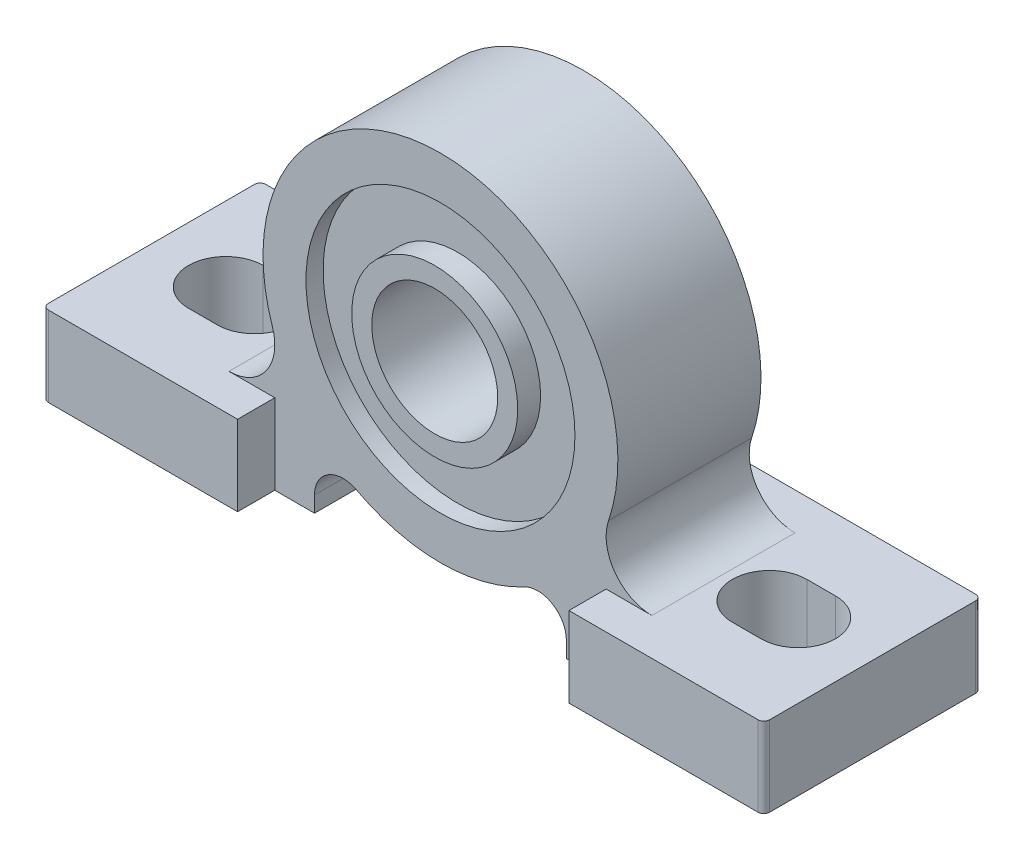
from build123d import *

# Parameters (mm, degrees)
SKETCH_8_R          = 14.5
SKETCH_8_R_2        = 11
EXTRUDE_1_DEPTH     = 31
SKETCH_10_R         = 23.5
SKETCH_10_R_2       = 14.5
EXTRUDE_2_DEPTH     = 17
EXTRUDE_START       = -5
SKETCH_11_R         = 31
SKETCH_11_R_2       = 23.5
EXTRUDE_3_DEPTH     = 25
SKETCH_13_W         = 41
SKETCH_13_H         = 38
EXTRUDE_4_DEPTH     = 14
FILLET_1_R          = 8
FILLET_2_R          = 5
FILLET_3_R          = 5
FILLET_4_R          = 8
FILLET_5_R          = 1
FILLET_6_R          = 1
SKETCH_14_W         = 12.689774382
SKETCH_14_H         = 9.496761799
CUT_EXTRUDE_5_DEPTH = 130.435312029


with BuildPart() as part:
    # Эскиз8 → Вытянуть1 (new body)
    with BuildSketch(Plane.XY):
        with Locations((50, -1.5)):
            Circle(SKETCH_8_R)
        with Locations((50, -1.5)):
            Circle(SKETCH_8_R_2, mode=Mode.SUBTRACT)
    extrude(amount=EXTRUDE_1_DEPTH)

    # Эскиз10 → Вытянуть2 (add)
    with BuildSketch(Plane.XY.offset(10)):
        with Locations((50, -1.5)):
            Circle(SKETCH_10_R)
        with Locations((50, -1.5)):
            Circle(SKETCH_10_R_2, mode=Mode.SUBTRACT)
    extrude(amount=EXTRUDE_2_DEPTH)

    # Эскиз11 → Вытянуть3 (add)
    with BuildSketch(Plane.XY.offset(10).offset(EXTRUDE_START)):
        with Locations((50, -1.5)):
            Circle(SKETCH_11_R)
        with Locations((50, -1.5)):
            Circle(SKETCH_11_R_2, mode=Mode.SUBTRACT)
    extrude(amount=EXTRUDE_3_DEPTH)

    # Эскиз13 → Вытянуть4 (add)
    # profile 1 of 2: a face of its own
    with BuildSketch(Plane(origin=(0, -36, 0), x_dir=(-1, 0, 0), z_dir=(0, 1, 0))):
        with Locations((-7.5, 17.5)):
            Rectangle(SKETCH_13_W, SKETCH_13_H)
        with BuildLine():
            Line((-4.740103958, 23.994802079), (0, 24))
            ThreePointArc((0, 24), (6.5, 17.5), (0, 11))
            Line((0, 11), (-5, 11))
            ThreePointArc((-5, 11), (-11.49870039, 17.629974008), (-4.740103958, 23.994802079))
        make_face(mode=Mode.SUBTRACT)
    # profile 2 of 2: a face of its own
    with BuildSketch(Plane(origin=(0, -36, 0), x_dir=(-1, 0, 0), z_dir=(0, 1, 0))):
        with Locations((-92.5, 17.5)):
            Rectangle(SKETCH_13_W, SKETCH_13_H)
        with BuildLine():
            Line((-95, 11), (-100, 11))
            ThreePointArc((-100, 11), (-106.5, 17.5), (-100, 24))
            Line((-100, 24), (-95.259896042, 23.994802079))
            ThreePointArc((-95.259896042, 23.994802079), (-88.50129961, 17.629974008), (-95, 11))
        make_face(mode=Mode.SUBTRACT)
    extrude(amount=EXTRUDE_4_DEPTH)

    # Скругление1
    fillet_1_edges = [part.edges().sort_by_distance(p)[0] for p in [
        (26.745968092, -22, 17.5),
    ]]
    fillet(fillet_1_edges, radius=FILLET_1_R)

    # Скругление2
    fillet_2_edges = [part.edges().sort_by_distance(p)[0] for p in [
        (28, -23.340329668, 17.5),
    ]]
    fillet(fillet_2_edges, radius=FILLET_2_R)

    # Скругление3
    fillet_3_edges = [part.edges().sort_by_distance(p)[0] for p in [
        (72, -23.340329668, 17.5),
    ]]
    fillet(fillet_3_edges, radius=FILLET_3_R)

    # Скругление4
    fillet_4_edges = [part.edges().sort_by_distance(p)[0] for p in [
        (73.254031908, -22, 17.5),
    ]]
    fillet(fillet_4_edges, radius=FILLET_4_R)

    # Скругление5
    fillet_5_edges = [part.edges().sort_by_distance(p)[0] for p in [
        (28, -29, 36.5),
        (28, -29, -1.5),
        (72, -29, -1.5),
        (72, -29, 36.5),
    ]]
    fillet(fillet_5_edges, radius=FILLET_5_R)

    # Скругление6
    fillet_6_edges = [part.edges().sort_by_distance(p)[0] for p in [
        (-13, -29, -1.5),
        (-13, -29, 36.5),
        (113, -29, 36.5),
        (113, -29, -1.5),
    ]]
    fillet(fillet_6_edges, radius=FILLET_6_R)

    # Эскиз14 → Вытянуть5 (cut, through all)
    with BuildSketch(Plane(origin=(0, -22, 0), x_dir=(1, 0, 0), z_dir=(0, 1, 0))):
        with Locations((27.402364267, -34.7483809)):
            Rectangle(SKETCH_14_W, SKETCH_14_H)
        with Locations((72.597635733, -34.7483809)):
            Rectangle(SKETCH_14_W, SKETCH_14_H)
    extrude(amount=-CUT_EXTRUDE_5_DEPTH, mode=Mode.SUBTRACT)


solid = part.part
